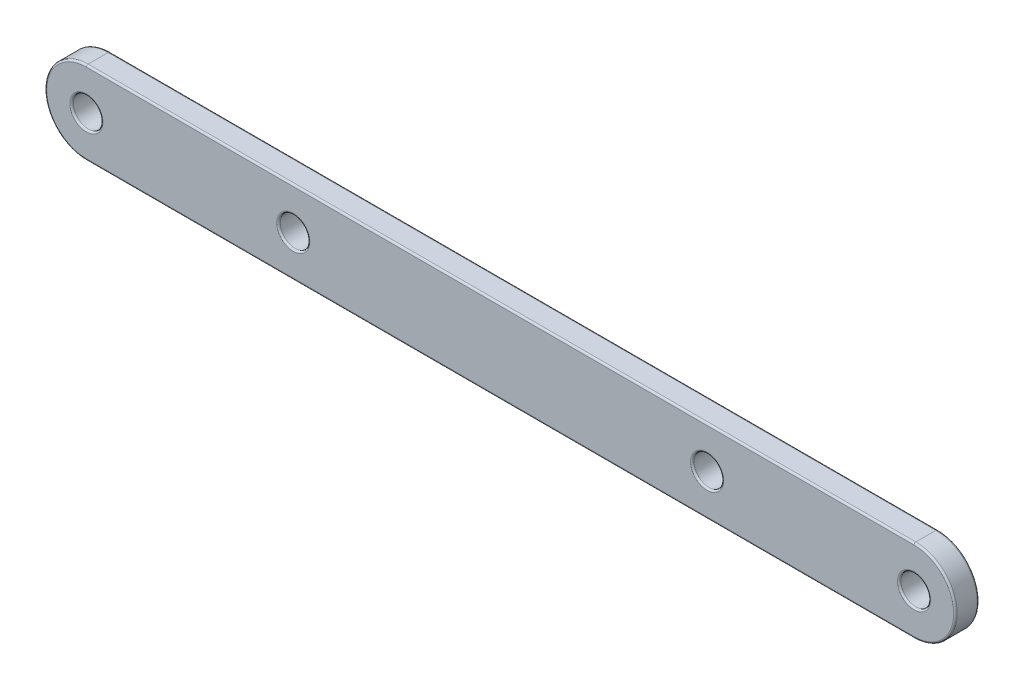
from build123d import *

# Parameters (mm, degrees)
SKETCH1_R           = 1.25
BOSS_EXTRUDE1_DEPTH = 2
FILLET1_R           = 0.15


with BuildPart() as part:
    # Sketch1 → Boss-Extrude1 (new body)
    with BuildSketch(Plane.XY):
        with BuildLine():
            Line((35, 3.5), (-35, 3.5))
            ThreePointArc((-35, 3.5), (-38.5, 0), (-35, -3.5))
            Line((-35, -3.5), (35, -3.5))
            ThreePointArc((35, -3.5), (38.5, 0), (35, 3.5))
        make_face()
        with Locations((-17.5, 0)):
            Circle(SKETCH1_R, mode=Mode.SUBTRACT)
        with Locations((-35, 0)):
            Circle(SKETCH1_R, mode=Mode.SUBTRACT)
        with Locations(Location((35, 0, 0), (0, 0, 180))):
            Circle(SKETCH1_R, mode=Mode.SUBTRACT)
        with Locations(Location((17.5, 0, 0), (0, 0, 180))):
            Circle(SKETCH1_R, mode=Mode.SUBTRACT)
    extrude(amount=BOSS_EXTRUDE1_DEPTH)

    # Fillet1
    fillet1_edges = [part.edges().sort_by_distance(p)[0] for p in [
        (-18.75, 0, 0),
        (-18.75, 0, 2),
        (38.5, 0, 2),
        (-36.25, 0, 0),
        (-36.25, 0, 2),
        (0, 3.5, 2),
        (36.25, 0, 0),
        (36.25, 0, 2),
        (18.75, 0, 0),
        (18.75, 0, 2),
        (-38.5, 0, 2),
        (0, 3.5, 0),
        (38.5, 0, 0),
        (0, -3.5, 0),
        (-38.5, 0, 0),
        (0, -3.5, 2),
    ]]
    fillet(fillet1_edges, radius=FILLET1_R)


solid = part.part
